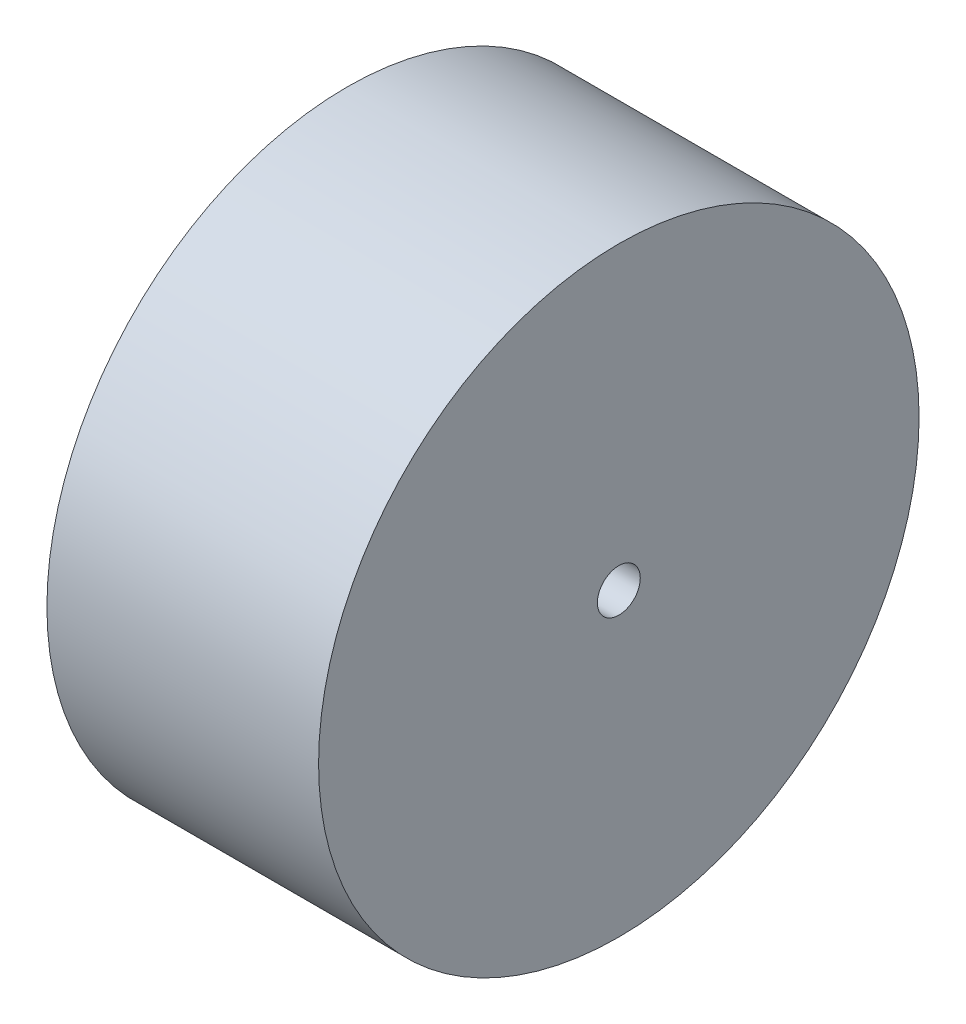
from build123d import *

# Parameters (mm, degrees)
SKETCH1_R           = 21
BOSS_EXTRUDE1_DEPTH = 19
SKETCH2_R           = 1.5
CUT_EXTRUDE1_DEPTH  = 36.256205128


with BuildPart() as part:
    # Sketch1 → Boss-Extrude1 (new body)
    with BuildSketch(Plane(origin=(0, 0, 0), x_dir=(0, 0, -1), z_dir=(1, 0, 0))):
        Circle(SKETCH1_R)
    extrude(amount=BOSS_EXTRUDE1_DEPTH)

    # Sketch2 → Cut-Extrude1 (cut, through all)
    with BuildSketch(Plane(origin=(19, 0, 0), x_dir=(0, 0, -1), z_dir=(1, 0, 0))):
        Circle(SKETCH2_R)
    extrude(amount=-CUT_EXTRUDE1_DEPTH, mode=Mode.SUBTRACT)


solid = part.part
